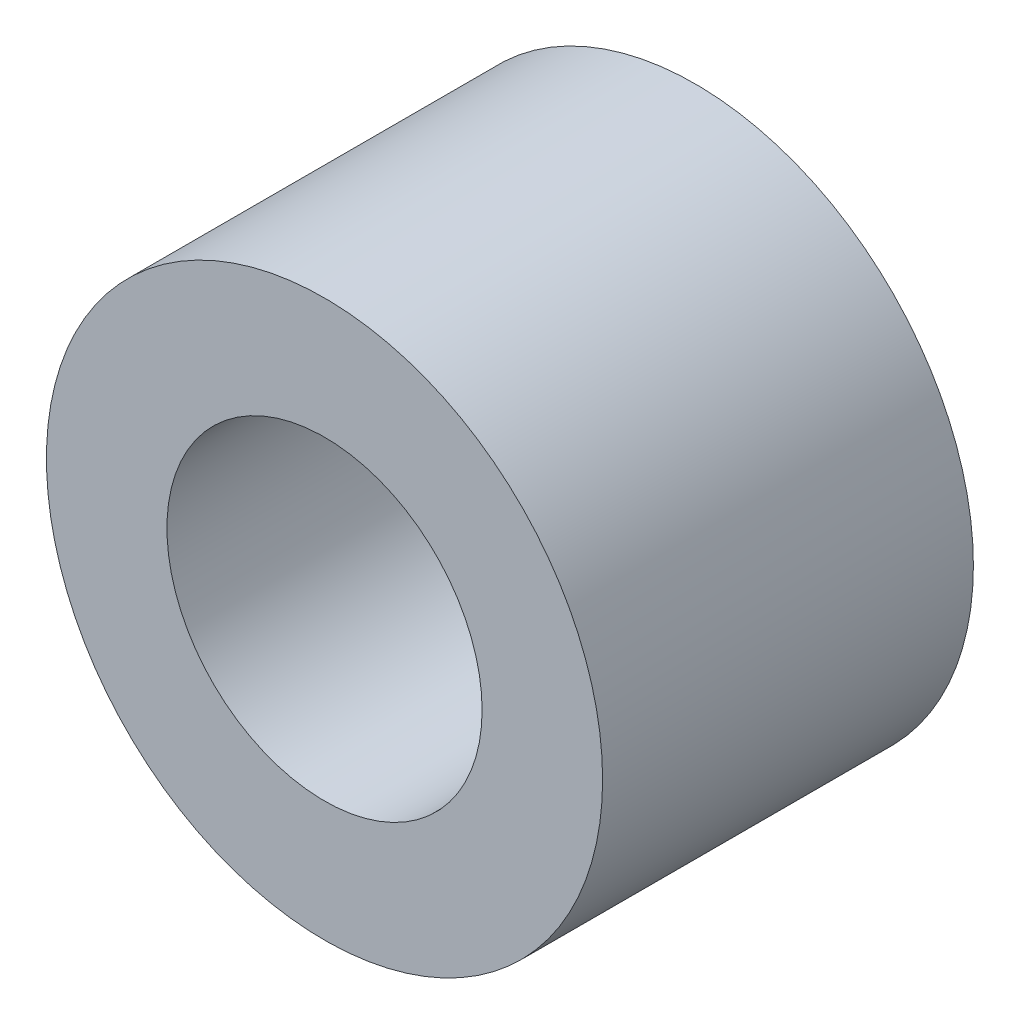
from build123d import *

# Parameters (mm, degrees)
SKETCH1_R         = 3
SKETCH1_R_2       = 1.7
BASE_SPACER_DEPTH = 4


with BuildPart() as part:
    # Sketch1 → Base_Spacer (new body)
    with BuildSketch(Plane.XY):
        Circle(SKETCH1_R)
        Circle(SKETCH1_R_2, mode=Mode.SUBTRACT)
    extrude(amount=BASE_SPACER_DEPTH)


solid = part.part
